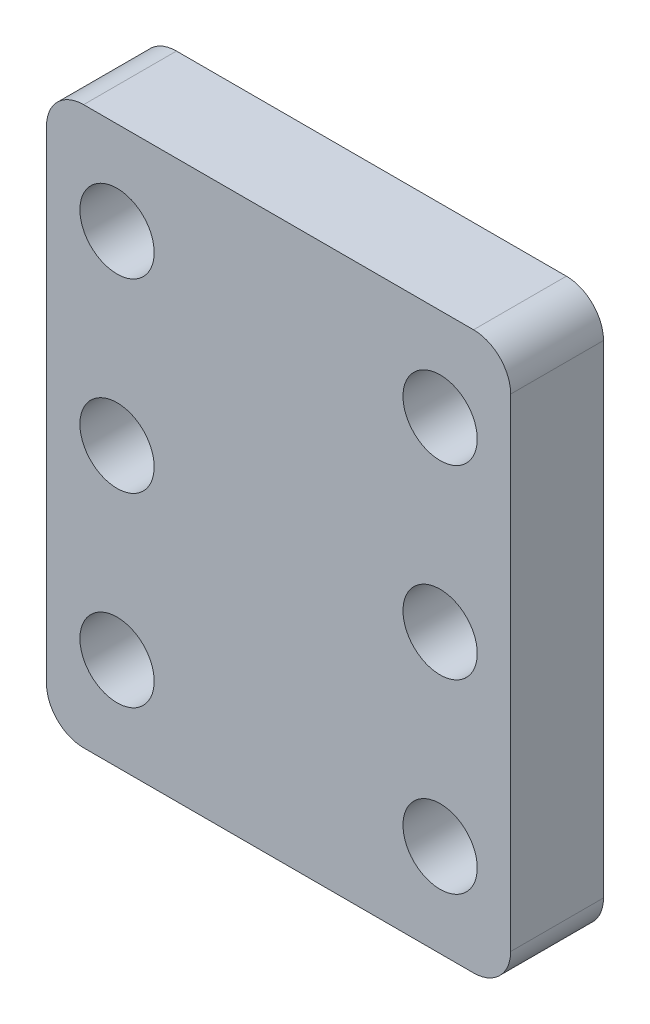
from build123d import *

# Parameters (mm, degrees)
SKETCH1_W           = 31.75
SKETCH1_H           = 38.1
BOSS_EXTRUDE1_DEPTH = 6.35
FILLET1_R           = 2.54
SKETCH4_R           = 2.54
CUT_EXTRUDE1_DEPTH  = 6.35


with BuildPart() as part:
    # Sketch1 → Boss-Extrude1 (new body)
    with BuildSketch(Plane.XY):
        with Locations((-25.611666667, 17.674166667)):
            Rectangle(SKETCH1_W, SKETCH1_H)
    extrude(amount=BOSS_EXTRUDE1_DEPTH)

    # Fillet1
    fillet1_edges = [part.edges().sort_by_distance(p)[0] for p in [
        (-9.736666667, 36.724166667, 3.175),
        (-9.736666667, -1.375833333, 3.175),
        (-41.486666667, -1.375833333, 3.175),
        (-41.486666667, 36.724166667, 3.175),
    ]]
    fillet(fillet1_edges, radius=FILLET1_R)

    # Sketch4 → Cut-Extrude1 (cut)
    with BuildSketch(Plane.XY.offset(6.35)):
        with Locations((-14.562666667, 30.374166667)):
            Circle(SKETCH4_R)
        with Locations((-14.562666667, 17.674166667)):
            Circle(SKETCH4_R)
        with Locations((-14.562666667, 4.974166667)):
            Circle(SKETCH4_R)
        with Locations(Location((-36.660666667, 4.974166667, 0), (0, 0, 180))):
            Circle(SKETCH4_R)
        with Locations(Location((-36.660666667, 17.674166667, 0), (0, 0, 180))):
            Circle(SKETCH4_R)
        with Locations(Location((-36.660666667, 30.374166667, 0), (0, 0, 180))):
            Circle(SKETCH4_R)
    extrude(amount=-CUT_EXTRUDE1_DEPTH, mode=Mode.SUBTRACT)


solid = part.part
